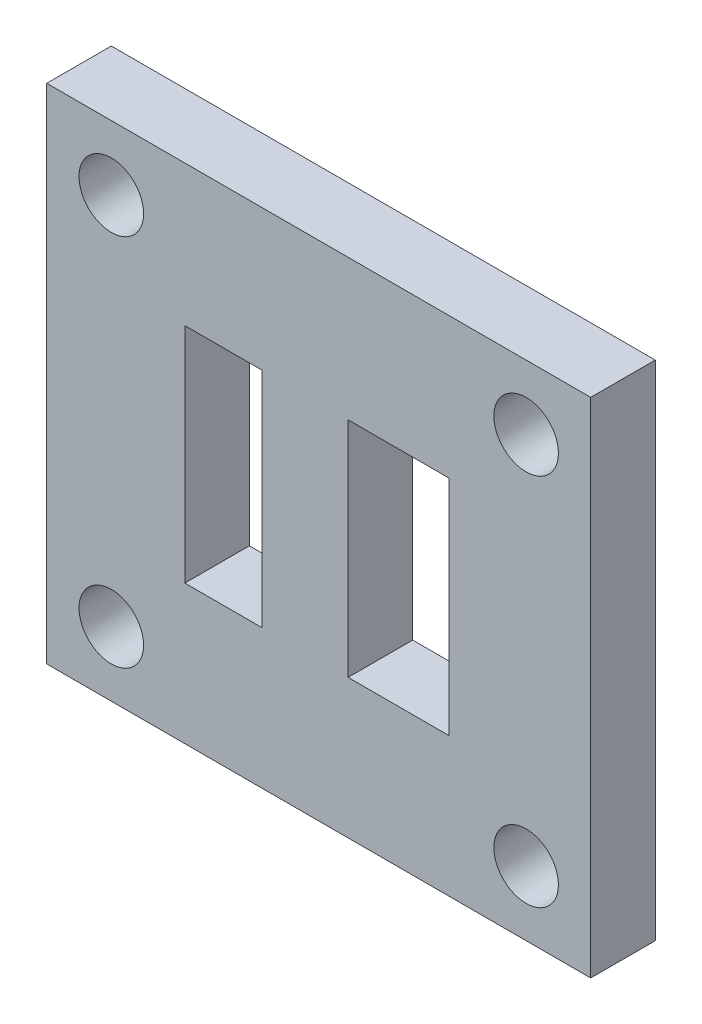
from build123d import *

# Parameters (mm, degrees)
SKETCH1_W           = 25.27
SKETCH1_H           = 23.36
SKETCH1_R           = 1.5
SKETCH1_W_2         = 12.27
SKETCH1_H_2         = 10.36
SKETCH1_W_3         = 4
BOSS_EXTRUDE1_DEPTH = 3


with BuildPart() as part:
    # Sketch1 → Boss-Extrude1 (new body)
    # profile 1 of 2: a face of its own
    with BuildSketch(Plane.XY):
        Rectangle(SKETCH1_W, SKETCH1_H)
        with Locations((-9.635, 8.68)):
            Circle(SKETCH1_R, mode=Mode.SUBTRACT)
        with Locations((-9.635, -8.68)):
            Circle(SKETCH1_R, mode=Mode.SUBTRACT)
        with Locations((9.635, -8.68)):
            Circle(SKETCH1_R, mode=Mode.SUBTRACT)
        with Locations((9.635, 8.68)):
            Circle(SKETCH1_R, mode=Mode.SUBTRACT)
        with Locations((-0.085, -0.04)):
            Rectangle(SKETCH1_W_2, SKETCH1_H_2, mode=Mode.SUBTRACT)
    # profile 2 of 2: a face of its own
    with BuildSketch(Plane.XY):
        with Locations((-0.635, -0.04)):
            Rectangle(SKETCH1_W_3, SKETCH1_H_2)
    extrude(amount=BOSS_EXTRUDE1_DEPTH)


solid = part.part
